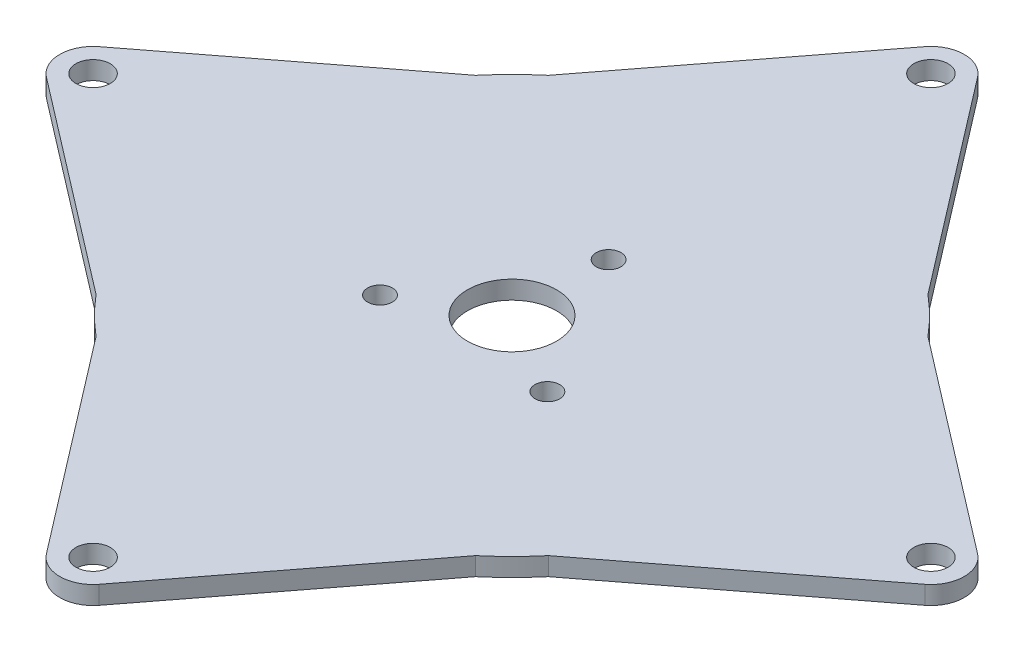
from build123d import *

# Parameters (mm, degrees)
SKETCH1_R           = 1.6
SKETCH1_R_2         = 1.15
SKETCH1_R_3         = 4.15
BOSS_EXTRUDE2_DEPTH = 1.7


with BuildPart() as part:
    # Sketch1 → Boss-Extrude2 (new body)
    with BuildSketch(Plane(origin=(0, 0, 0), x_dir=(1, 0, 0), z_dir=(0, 1, 0))):
        with BuildLine():
            Line((-17.673720383, -21.068687852), (-2.459890554, -40.906514899))
            ThreePointArc((-2.459890554, -40.906514899), (0, -42.12), (2.459890554, -40.906514899))
            Line((2.459890554, -40.906514899), (17.673720383, -21.068687852))
            ThreePointArc((17.673720383, -21.068687852), (19.445436483, -19.445436483), (21.068687852, -17.673720383))
            Line((21.068687852, -17.673720383), (40.906514899, -2.459890554))
            ThreePointArc((40.906514899, -2.459890554), (42.12, 0), (40.906514899, 2.459890554))
            Line((40.906514899, 2.459890554), (21.068687852, 17.673720383))
            ThreePointArc((21.068687852, 17.673720383), (19.445436483, 19.445436483), (17.673720383, 21.068687852))
            Line((17.673720383, 21.068687852), (2.459890554, 40.906514899))
            ThreePointArc((2.459890554, 40.906514899), (0, 42.12), (-2.459890554, 40.906514899))
            Line((-2.459890554, 40.906514899), (-17.673720383, 21.068687852))
            ThreePointArc((-17.673720383, 21.068687852), (-19.445436483, 19.445436483), (-21.068687852, 17.673720383))
            Line((-21.068687852, 17.673720383), (-40.906514899, 2.459890554))
            ThreePointArc((-40.906514899, 2.459890554), (-42.12, 0), (-40.906514899, -2.459890554))
            Line((-40.906514899, -2.459890554), (-21.068687852, -17.673720383))
            ThreePointArc((-21.068687852, -17.673720383), (-19.445436483, -19.445436483), (-17.673720383, -21.068687852))
        make_face()
        with Locations(Location((0, -39.02, 0), (0, 0, 270))):
            Circle(SKETCH1_R, mode=Mode.SUBTRACT)
        with Locations(Location((0, 9, 0), (0, 0, 270))):
            Circle(SKETCH1_R_2, mode=Mode.SUBTRACT)
        with Locations(Location((-7.794228634, -4.5, 0), (0, 0, 270))):
            Circle(SKETCH1_R_2, mode=Mode.SUBTRACT)
        with Locations(Location((7.794228634, -4.5, 0), (0, 0, 270))):
            Circle(SKETCH1_R_2, mode=Mode.SUBTRACT)
        with Locations(Location((0, 0, 0), (0, 0, 270))):
            Circle(SKETCH1_R_3, mode=Mode.SUBTRACT)
        with Locations(Location((-39.02, 0, 0), (0, 0, 270))):
            Circle(SKETCH1_R, mode=Mode.SUBTRACT)
        with Locations(Location((39.02, 0, 0), (0, 0, 270))):
            Circle(SKETCH1_R, mode=Mode.SUBTRACT)
        with Locations(Location((0, 39.02, 0), (0, 0, 270))):
            Circle(SKETCH1_R, mode=Mode.SUBTRACT)
    extrude(amount=BOSS_EXTRUDE2_DEPTH)


solid = part.part
